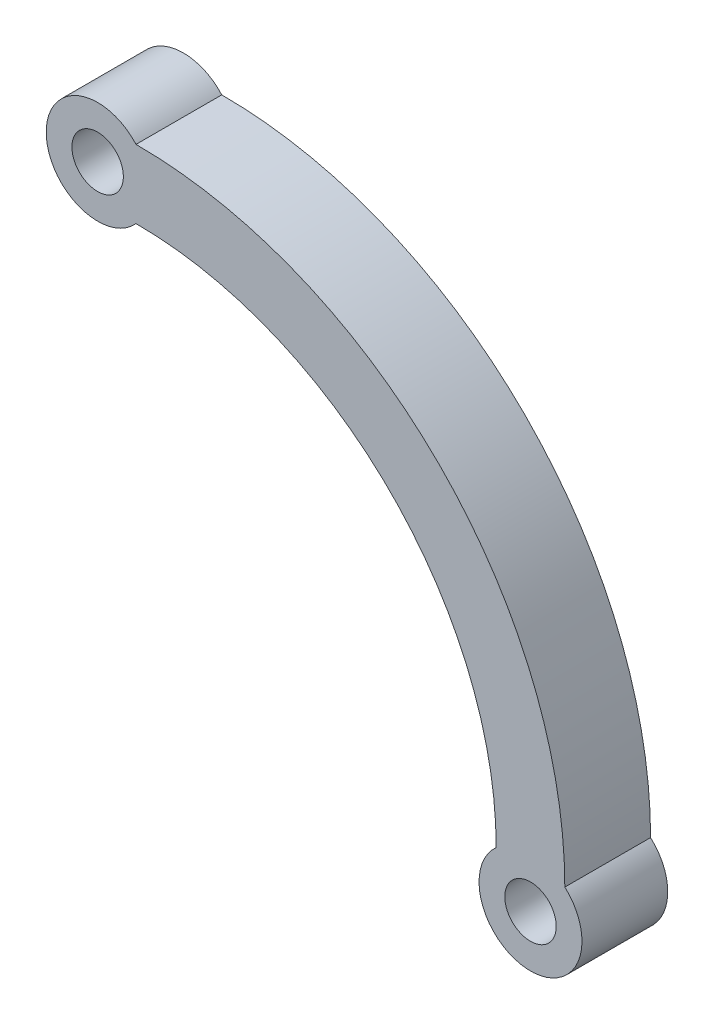
from build123d import *

# Parameters (mm, degrees)
BOSS_EXTRU_1_DEPTH      = 10
BOSS_EXTRU_2_DEPTH      = 10
ESQUISSE3_R             = 3
ENL_V_MAT_EXTRU_1_DEPTH = 10


with BuildPart() as part:
    # Esquisse1 → Boss.-Extru.1 (new body)
    with BuildSketch(Plane.XY):
        with BuildLine():
            Line((0, 42), (0, 50))
            ThreePointArc((0, 50), (35.355339059, 35.355339059), (50, 0))
            Line((50, 0), (42, 0))
            ThreePointArc((42, 0), (29.69848481, 29.69848481), (0, 42))
        make_face()
    extrude(amount=BOSS_EXTRU_1_DEPTH)

    # Esquisse2 → Boss.-Extru.2 (add)
    with BuildSketch(Plane.XY.offset(10)):
        with BuildLine():
            Line((0, 42), (0, 50))
            ThreePointArc((0, 50), (-10.472135955, 46), (0, 42))
        make_face()
        with BuildLine():
            Line((42, 0), (50, 0))
            ThreePointArc((50, 0), (46, -10.472135955), (42, 0))
        make_face()
    extrude(amount=-BOSS_EXTRU_2_DEPTH)

    # Esquisse3 → Enlèv. mat.-Extru.1 (cut)
    with BuildSketch(Plane.XY.offset(10)):
        with Locations((46, -4.472135955)):
            Circle(ESQUISSE3_R)
        with Locations((-4.472135955, 46)):
            Circle(ESQUISSE3_R)
    extrude(amount=-ENL_V_MAT_EXTRU_1_DEPTH, mode=Mode.SUBTRACT)


solid = part.part
